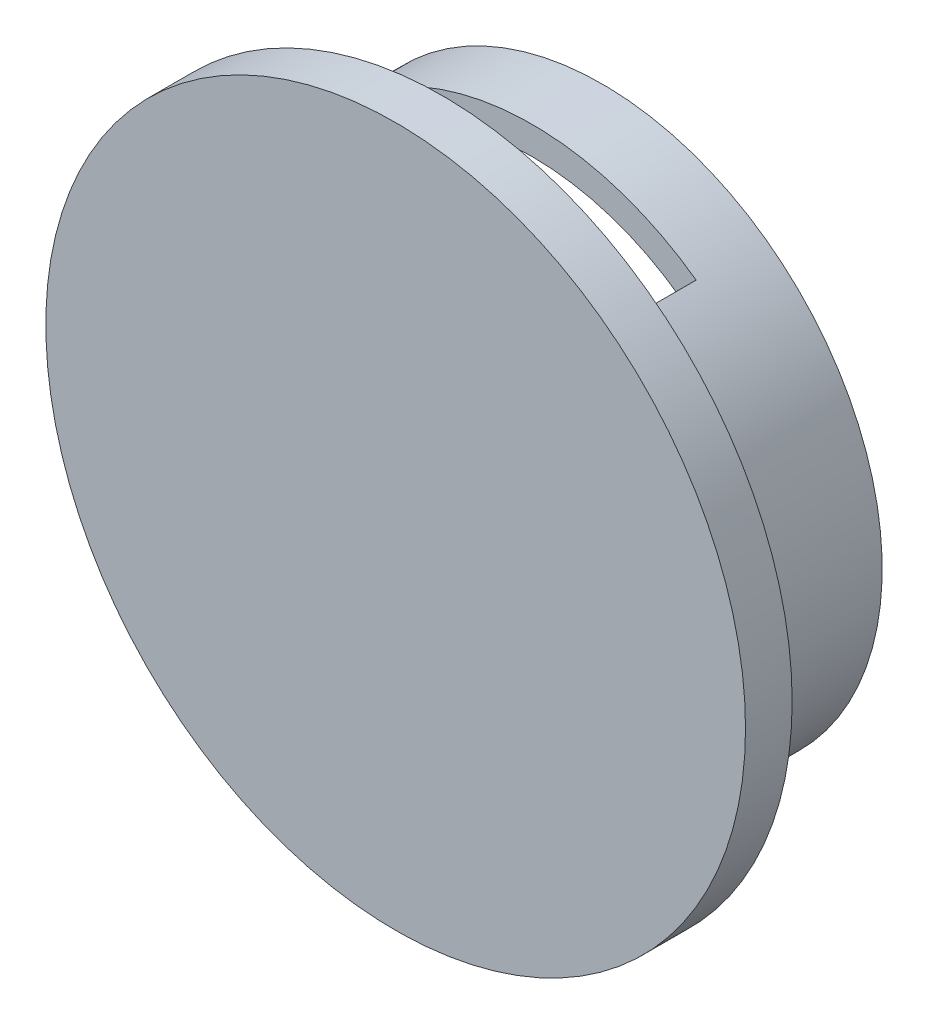
from build123d import *

# Parameters (mm, degrees)
SKETCH_2_R                    = 75
EXTRUDE_1_DEPTH               = 10
SKETCH_3_R                    = 60
EXTRUDE_3_DEPTH               = 34.3
SHELL_2_T                     = -6
CUT_EXTRUDE_START             = -25
CUT_EXTRUDE_2_DEPTH           = 25
EXTRUDE_START                 = -15
EXTRUDE_4_DEPTH               = 15
HOLE_WIZARD_M3_5_1_AT_2_COUNT = 2
HOLE_WIZARD_M3_5_1_AT_2_PITCH = 60.104076401
HOLE_WIZARD_M3_5_1_AT_3_COUNT = 2
HOLE_WIZARD_M3_5_1_AT_3_PITCH = 85
HOLE_WIZARD_M3_5_1_AT_4_COUNT = 2
HOLE_WIZARD_M3_5_1_AT_4_PITCH = 60.104076401
PATTERN_CIRCULAR_1_COUNT      = 4
PATTERN_CIRCULAR_1_ANGLE      = 135


with BuildPart() as part:
    # 草图2 → 凸台-拉伸1 (new body)
    with BuildSketch(Plane.XY):
        with Locations((-40.151148837, 28.730605226)):
            Circle(SKETCH_2_R)
    extrude(amount=EXTRUDE_1_DEPTH)

    # 草图3 → 凸台-拉伸3 (add)
    with BuildSketch(Plane(origin=(0, 0, 0), x_dir=(-1, 0, 0), z_dir=(0, 0, -1))):
        with Locations((40.151148837, 28.730605226)):
            Circle(SKETCH_3_R)
    extrude(amount=EXTRUDE_3_DEPTH)

    # 抽壳2
    shell_2_openings = [part.faces().sort_by_distance(p)[0] for p in [
        (-40.151148837, 28.730605226, -34.3),
    ]]
    offset(amount=SHELL_2_T, openings=shell_2_openings, kind=Kind.INTERSECTION)

    # 草图5 → 切除-拉伸2 (cut)
    with BuildSketch(Plane(origin=(0, 0, -34.3), x_dir=(-1, 0, 0), z_dir=(0, 0, -1)).offset(CUT_EXTRUDE_START)):
        with BuildLine():
            ThreePointArc((75.263111693, 77.38397165), (40.151148837, 88.730605226), (5.039185981, 77.38397165))
            Line((5.039185981, 77.38397165), (5.039185981, 69.756817145))
            ThreePointArc((5.039185981, 69.756817145), (40.151148837, 82.730605226), (75.263111693, 69.756817145))
            Line((75.263111693, 69.756817145), (75.263111693, 77.38397165))
        make_face()
        with BuildLine():
            Line((5.039185981, -12.295606692), (5.039185981, -19.922761198))
            ThreePointArc((5.039185981, -19.922761198), (40.567011683, -31.267953574), (75.934159557, -19.43137297))
            Line((75.934159557, -19.43137297), (75.934159557, -11.711651681))
            ThreePointArc((75.934159557, -11.711651681), (40.595926503, -25.26756301), (5.039185981, -12.295606692))
        make_face()
    extrude(amount=CUT_EXTRUDE_2_DEPTH, mode=Mode.SUBTRACT)

    # 草图6 → 凸台-拉伸4 (add)
    with BuildSketch(Plane(origin=(0, 0, -34.3), x_dir=(-1, 0, 0), z_dir=(0, 0, -1)).offset(EXTRUDE_START)):
        with BuildLine():
            Line((5.039185981, 77.38397165), (5.039185981, 69.756817145))
            ThreePointArc((5.039185981, 69.756817145), (40.151148837, 82.730605226), (75.263111693, 69.756817145))
            Line((75.263111693, 69.756817145), (75.263111693, 77.38397165))
            ThreePointArc((75.263111693, 77.38397165), (40.151148837, 88.730605226), (5.039185981, 77.38397165))
        make_face()
        with BuildLine():
            Line((75.934159557, -11.711651681), (75.934159557, -19.43137297))
            ThreePointArc((75.934159557, -19.43137297), (40.567011683, -31.267953574), (5.039185981, -19.922761198))
            Line((5.039185981, -19.922761198), (5.039185981, -12.295606692))
            ThreePointArc((5.039185981, -12.295606692), (40.595926503, -25.26756301), (75.934159557, -11.711651681))
        make_face()
    extrude(amount=EXTRUDE_4_DEPTH)

    # 草图10 → M3.5 螺纹孔1 (revolve, cut)
    with BuildSketch(Plane(origin=(2.348851163, 28.730605226, 4), x_dir=(0, 1, 0), z_dir=(1, 0, 0))):
        Polygon((0, 0), (0, 5.871247898), (1.45, 5), (1.45, 0.325), (1.775, 0), align=None)
    hole_wizard_m3_5_1 = revolve(axis=Axis((2.348851163, 28.730605226, -2.35), (0, 0, 1)), mode=Mode.SUBTRACT)

    # M3.5 螺纹孔1 at 2: M3.5 螺纹孔1 ×2
    with Locations(*[Vector(-0.7071067811865475, 0.7071067811865476, 0) * (i * HOLE_WIZARD_M3_5_1_AT_2_PITCH) for i in range(1, HOLE_WIZARD_M3_5_1_AT_2_COUNT)]):
        add(hole_wizard_m3_5_1, mode=Mode.SUBTRACT)

    # M3.5 螺纹孔1 at 3: M3.5 螺纹孔1 ×2
    with Locations(*[(-i * HOLE_WIZARD_M3_5_1_AT_3_PITCH, 0, 0) for i in range(1, HOLE_WIZARD_M3_5_1_AT_3_COUNT)]):
        add(hole_wizard_m3_5_1, mode=Mode.SUBTRACT)

    # M3.5 螺纹孔1 at 4: M3.5 螺纹孔1 ×2
    with Locations(*[Vector(-0.7071067811865476, -0.7071067811865476, 0) * (i * HOLE_WIZARD_M3_5_1_AT_4_PITCH) for i in range(1, HOLE_WIZARD_M3_5_1_AT_4_COUNT)]):
        add(hole_wizard_m3_5_1, mode=Mode.SUBTRACT)

    # 阵列(圆周)1: M3.5 螺纹孔1 ×4 about axis
    pattern_circular_1_axis = Axis((-40.151148837, 28.730605226, 0), (0, 0, -1))
    for i in range(1, PATTERN_CIRCULAR_1_COUNT):
        add(hole_wizard_m3_5_1.rotate(pattern_circular_1_axis, i * PATTERN_CIRCULAR_1_ANGLE / (PATTERN_CIRCULAR_1_COUNT - 1)), mode=Mode.SUBTRACT)

    # 阵列(圆周)1 copy 1 sketch → 阵列(圆周)1 copy 1 (revolve, cut)
    with BuildSketch(Plane(origin=(-10.099110636, 58.782643427, 4), x_dir=(0.7071067811865487, 0.7071067811865464, 0), z_dir=(0.7071067811865464, -0.7071067811865487, 0))):
        Polygon((0, 0), (0, 5.871247898), (1.45, 5), (1.45, 0.325), (1.775, 0), align=None)
    revolve(axis=Axis((-10.099110636, 58.782643427, -2.35), (0, 0, 1)), mode=Mode.SUBTRACT)

    # 阵列(圆周)1 copy 2 sketch → 阵列(圆周)1 copy 2 (revolve, cut)
    with BuildSketch(Plane(origin=(2.348851163, 28.730605226, 4), x_dir=(1, 0, 0), z_dir=(0, -1, 0))):
        Polygon((0, 0), (0, 5.871247898), (1.45, 5), (1.45, 0.325), (1.775, 0), align=None)
    revolve(axis=Axis((2.348851163, 28.730605226, -2.35), (0, 0, 1)), mode=Mode.SUBTRACT)

    # 阵列(圆周)1 copy 3 sketch → 阵列(圆周)1 copy 3 (revolve, cut)
    with BuildSketch(Plane(origin=(-10.099110636, -1.321432974, 4), x_dir=(0.7071067811865441, -0.7071067811865509, 0), z_dir=(-0.7071067811865509, -0.7071067811865441, 0))):
        Polygon((0, 0), (0, 5.871247898), (1.45, 5), (1.45, 0.325), (1.775, 0), align=None)
    revolve(axis=Axis((-10.099110636, -1.321432974, -2.35), (0, 0, 1)), mode=Mode.SUBTRACT)

    # 阵列(圆周)1 copy 4 sketch → 阵列(圆周)1 copy 4 (revolve, cut)
    with BuildSketch(Plane(origin=(-70.203187037, 58.782643427, 4), x_dir=(0.7071067811865487, 0.7071067811865464, 0), z_dir=(0.7071067811865464, -0.7071067811865487, 0))):
        Polygon((0, 0), (0, 5.871247898), (1.45, 5), (1.45, 0.325), (1.775, 0), align=None)
    revolve(axis=Axis((-70.203187037, 58.782643427, -2.35), (0, 0, 1)), mode=Mode.SUBTRACT)

    # 阵列(圆周)1 copy 5 sketch → 阵列(圆周)1 copy 5 (revolve, cut)
    with BuildSketch(Plane(origin=(-40.151148837, 71.230605226, 4), x_dir=(1, 0, 0), z_dir=(0, -1, 0))):
        Polygon((0, 0), (0, 5.871247898), (1.45, 5), (1.45, 0.325), (1.775, 0), align=None)
    revolve(axis=Axis((-40.151148837, 71.230605226, -2.35), (0, 0, 1)), mode=Mode.SUBTRACT)

    # 阵列(圆周)1 copy 6 sketch → 阵列(圆周)1 copy 6 (revolve, cut)
    with BuildSketch(Plane(origin=(-10.099110636, 58.782643427, 4), x_dir=(0.7071067811865441, -0.7071067811865509, 0), z_dir=(-0.7071067811865509, -0.7071067811865441, 0))):
        Polygon((0, 0), (0, 5.871247898), (1.45, 5), (1.45, 0.325), (1.775, 0), align=None)
    revolve(axis=Axis((-10.099110636, 58.782643427, -2.35), (0, 0, 1)), mode=Mode.SUBTRACT)

    # 阵列(圆周)1 copy 7 sketch → 阵列(圆周)1 copy 7 (revolve, cut)
    with BuildSketch(Plane(origin=(-70.203187037, -1.321432974, 4), x_dir=(0.7071067811865487, 0.7071067811865464, 0), z_dir=(0.7071067811865464, -0.7071067811865487, 0))):
        Polygon((0, 0), (0, 5.871247898), (1.45, 5), (1.45, 0.325), (1.775, 0), align=None)
    revolve(axis=Axis((-70.203187037, -1.321432974, -2.35), (0, 0, 1)), mode=Mode.SUBTRACT)

    # 阵列(圆周)1 copy 8 sketch → 阵列(圆周)1 copy 8 (revolve, cut)
    with BuildSketch(Plane(origin=(-82.651148837, 28.730605226, 4), x_dir=(1, 0, 0), z_dir=(0, -1, 0))):
        Polygon((0, 0), (0, 5.871247898), (1.45, 5), (1.45, 0.325), (1.775, 0), align=None)
    revolve(axis=Axis((-82.651148837, 28.730605226, -2.35), (0, 0, 1)), mode=Mode.SUBTRACT)

    # 阵列(圆周)1 copy 9 sketch → 阵列(圆周)1 copy 9 (revolve, cut)
    with BuildSketch(Plane(origin=(-70.203187037, 58.782643427, 4), x_dir=(0.7071067811865441, -0.7071067811865509, 0), z_dir=(-0.7071067811865509, -0.7071067811865441, 0))):
        Polygon((0, 0), (0, 5.871247898), (1.45, 5), (1.45, 0.325), (1.775, 0), align=None)
    revolve(axis=Axis((-70.203187037, 58.782643427, -2.35), (0, 0, 1)), mode=Mode.SUBTRACT)


solid = part.part
